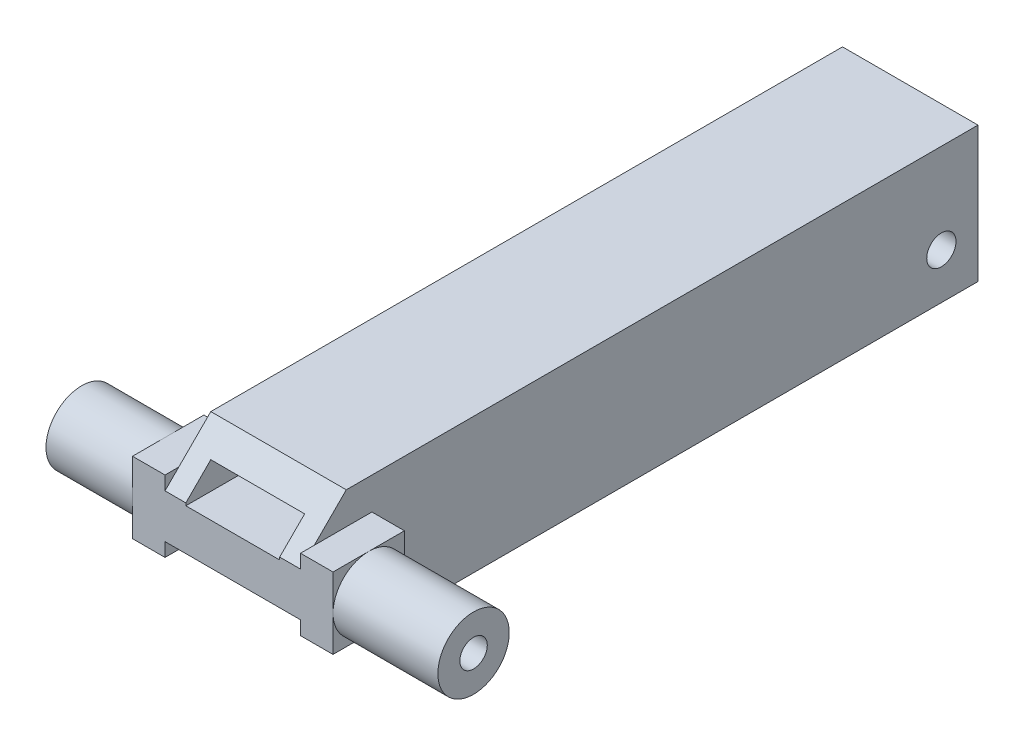
from build123d import *

# Parameters (mm, degrees)
SKETCH_1_W          = 74
SKETCH_1_H          = 14.8
EXTRUDE_1_DEPTH     = 14.8
SKETCH_2_W          = 10.25
SKETCH_2_H          = 10.25
CUT_EXTRUDE_1_DEPTH = 65
SKETCH_3_R          = 3.9
EXTRUDE_2_DEPTH     = 15
EXTRUDE_START       = 13
SKETCH_4_R          = 3.9
EXTRUDE_3_DEPTH     = 13
CHAMFER_1_SIZE      = 5
SKETCH_8_R          = 1.45
CUT_EXTRUDE_4_DEPTH = 58.057865365
SKETCH_9_W          = 7.8
SKETCH_9_H          = 7.8
SKETCH_9_R          = 1.5
EXTRUDE_4_DEPTH     = 3.55
SKETCH_10_W         = 7.8
SKETCH_10_H         = 7.8
EXTRUDE_5_DEPTH     = 3.55
SKETCH1_R           = 1.6
CUT_EXTRUDE1_DEPTH  = 49.08118135
SKETCH2_R           = 1.5
CUT_EXTRUDE2_DEPTH  = 58.057865365
SKETCH3_W           = 10.25
SKETCH3_H           = 3
CUT_EXTRUDE3_DEPTH  = 72.887411972


with BuildPart() as part:
    # Эскиз1 → Бобышка-Вытянуть1 (new body)
    with BuildSketch(Plane(origin=(0, 0, 0), x_dir=(0, 0, -1), z_dir=(1, 0, 0))):
        Rectangle(SKETCH_1_W, SKETCH_1_H)
    extrude(amount=EXTRUDE_1_DEPTH)

    # Эскиз2 → Вырез-Вытянуть1 (cut)
    with BuildSketch(Plane(origin=(0, 0, -37), x_dir=(-1, 0, 0), z_dir=(0, 0, -1))):
        with Locations((-7.4, 0)):
            Rectangle(SKETCH_2_W, SKETCH_2_H)
    extrude(amount=-CUT_EXTRUDE_1_DEPTH, mode=Mode.SUBTRACT)

    # Эскиз3 → Бобышка-Вытянуть2 (add)
    with BuildSketch(Plane(origin=(14.8, 0, 0), x_dir=(0, 0, -1), z_dir=(1, 0, 0))):
        with Locations(Location((-33.1, 0, 0), (0, 0, 180))):
            Circle(SKETCH_3_R)
    extrude(amount=EXTRUDE_2_DEPTH)

    # Эскиз4 → Бобышка-Вытянуть3 (add)
    with BuildSketch(Plane.ZY.offset(EXTRUDE_START)):
        with Locations((33.1, 0)):
            Circle(SKETCH_4_R)
    extrude(amount=-EXTRUDE_3_DEPTH)

    # Фаска1
    chamfer_1_edges = [part.edges().sort_by_distance(p)[0] for p in [
        (7.4, 7.4, 37),
        (7.4, -7.4, 37),
    ]]
    chamfer(chamfer_1_edges, length=CHAMFER_1_SIZE)

    # Эскиз8 → Вырез-Вытянуть4 (cut, through all)
    with BuildSketch(Plane(origin=(29.8, 0, 0), x_dir=(0, 0, -1), z_dir=(1, 0, 0))):
        with Locations((-33.1, 0)):
            Circle(SKETCH_8_R)
    extrude(amount=-CUT_EXTRUDE_4_DEPTH, mode=Mode.SUBTRACT)

    # Эскиз9 → Бобышка-Вытянуть4 (add)
    with BuildSketch(Plane.ZY):
        with Locations((33.1, 0)):
            Rectangle(SKETCH_9_W, SKETCH_9_H)
        with Locations((33.1, 0)):
            Circle(SKETCH_9_R, mode=Mode.SUBTRACT)
    extrude(amount=EXTRUDE_4_DEPTH)

    # Эскиз10 → Бобышка-Вытянуть5 (add)
    with BuildSketch(Plane(origin=(14.8, 0, 0), x_dir=(0, 0, -1), z_dir=(1, 0, 0))):
        with Locations((-33.1, 0)):
            Rectangle(SKETCH_10_W, SKETCH_10_H)
    extrude(amount=EXTRUDE_5_DEPTH)

    # Sketch1 → Cut-Extrude1 (cut, through all)
    with BuildSketch(Plane.ZY):
        with Locations((-33, -2.4)):
            Circle(SKETCH1_R)
    extrude(amount=-CUT_EXTRUDE1_DEPTH, mode=Mode.SUBTRACT)

    # Sketch2 → Cut-Extrude2 (cut, through all)
    with BuildSketch(Plane(origin=(29.8, 0, 0), x_dir=(0, 0, -1), z_dir=(1, 0, 0))):
        with Locations((-33.1, 0)):
            Circle(SKETCH2_R)
    extrude(amount=-CUT_EXTRUDE2_DEPTH, mode=Mode.SUBTRACT)

    # Sketch3 → Cut-Extrude3 (cut, through all)
    with BuildSketch(Plane(origin=(0, 0, 28), x_dir=(-1, 0, 0), z_dir=(0, 0, -1))):
        with Locations((-7.4, 3.625)):
            Rectangle(SKETCH3_W, SKETCH3_H)
    extrude(amount=-CUT_EXTRUDE3_DEPTH, mode=Mode.SUBTRACT)


solid = part.part
